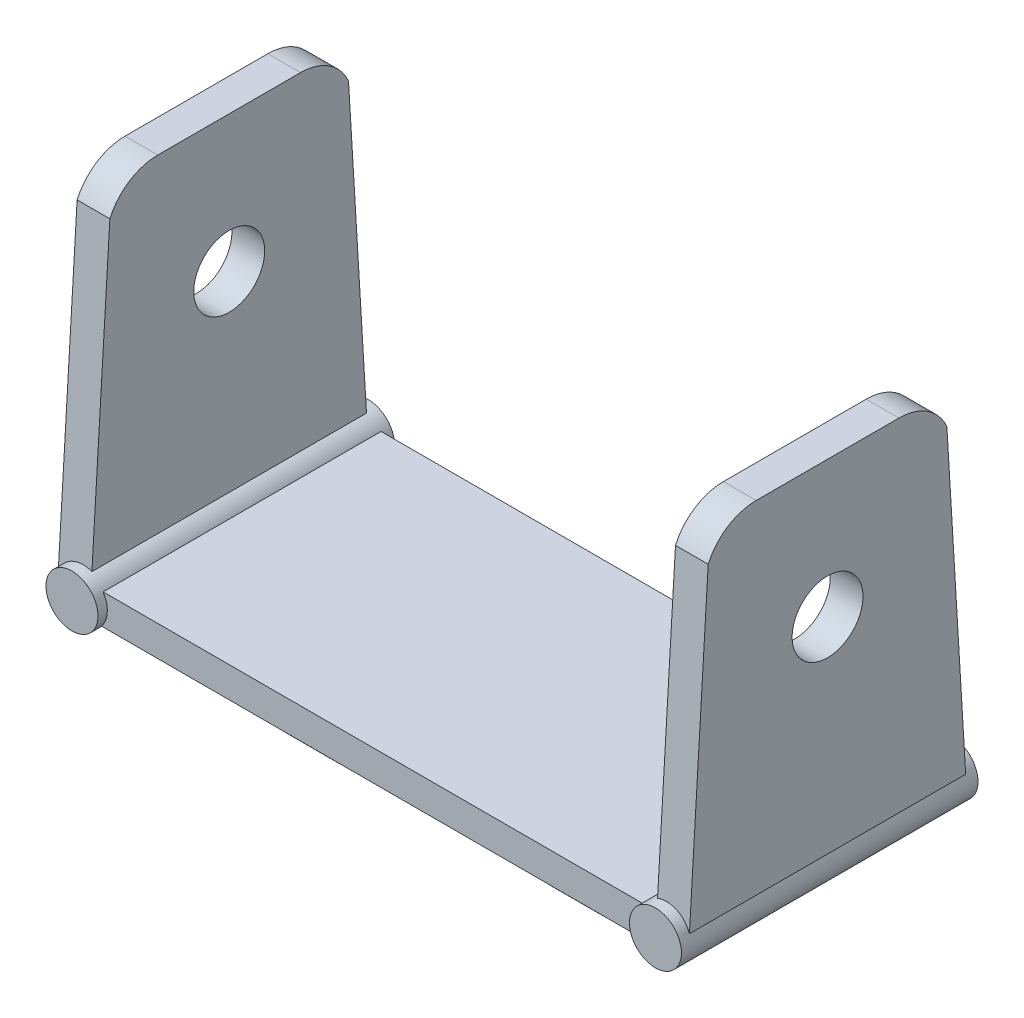
from build123d import *

# Parameters (mm, degrees)
SKETCH1_W           = 253.301246
SKETCH1_H           = 124.905262
BOSS_EXTRUDE1_DEPTH = 13.704316
SKETCH3_R           = 11.68527
BOSS_EXTRUDE6_DEPTH = 133.294628
SKETCH4_R           = 13.935202
BOSS_EXTRUDE7_DEPTH = 24.061166
SKETCH2_R           = 15.942437
BOSS_EXTRUDE8_DEPTH = 14.713204


with BuildPart() as part:
    # Sketch1 → Boss-Extrude1 (new body)
    with BuildSketch(Plane(origin=(0, 0, 0), x_dir=(1, 0, 0), z_dir=(0, 1, 0))):
        Rectangle(SKETCH1_W, SKETCH1_H)
    extrude(amount=BOSS_EXTRUDE1_DEPTH)

    # Sketch3 → Boss-Extrude6 (add)
    with BuildSketch(Plane.XY.offset(66.647314)):
        with Locations((131.1274492, 7.338568)):
            Circle(SKETCH3_R)
    boss_extrude6 = extrude(amount=-BOSS_EXTRUDE6_DEPTH)

    # Sketch4 → Boss-Extrude7 (add)
    with BuildSketch(Plane(origin=(47.4016832, 0, 0), x_dir=(0, 0, -1), z_dir=(1, 0, 0))):
        with BuildLine():
            Line((-44.216574, 0), (44.216574, 0))
            ThreePointArc((44.216574, 0), (0, -44.216574), (-44.216574, 0))
        make_face()
        with Locations(Location((0, -19.057366, 0), (0, 0, 180))):
            Circle(SKETCH4_R, mode=Mode.SUBTRACT)
    boss_extrude7 = extrude(amount=BOSS_EXTRUDE7_DEPTH)

    # Sketch2 → Boss-Extrude8 (add)
    with BuildSketch(Plane(origin=(127.120142, 0, 0), x_dir=(0, 0, -1), z_dir=(1, 0, 0))):
        with BuildLine():
            Line((-62.49035, 5.388102), (62.49035, 5.388102))
            Line((62.49035, 5.388102), (53.638831, 151.624284))
            ThreePointArc((53.638831, 151.624284), (44.950710882, 161.858546774), (32.082613, 165.6842))
            Line((32.082613, 165.6842), (-32.082613, 165.6842))
            ThreePointArc((-32.082613, 165.6842), (-44.950710882, 161.858546774), (-53.638831, 151.624284))
            Line((-53.638831, 151.624284), (-62.49035, 5.388102))
        make_face()
        with Locations(Location((0, 104.354376, 0), (0, 0, 180))):
            Circle(SKETCH2_R, mode=Mode.SUBTRACT)
    boss_extrude8 = extrude(amount=BOSS_EXTRUDE8_DEPTH)

    # Mirror5: Boss-Extrude6, Boss-Extrude7, Boss-Extrude8 across plane
    add(boss_extrude6.mirror(Plane(origin=(0, 0, 0), x_dir=(0, 0, 1), z_dir=(1, 0, 0))))
    add(boss_extrude7.mirror(Plane(origin=(0, 0, 0), x_dir=(0, 0, 1), z_dir=(1, 0, 0))))
    add(boss_extrude8.mirror(Plane(origin=(0, 0, 0), x_dir=(0, 0, 1), z_dir=(1, 0, 0))))


solid = part.part
